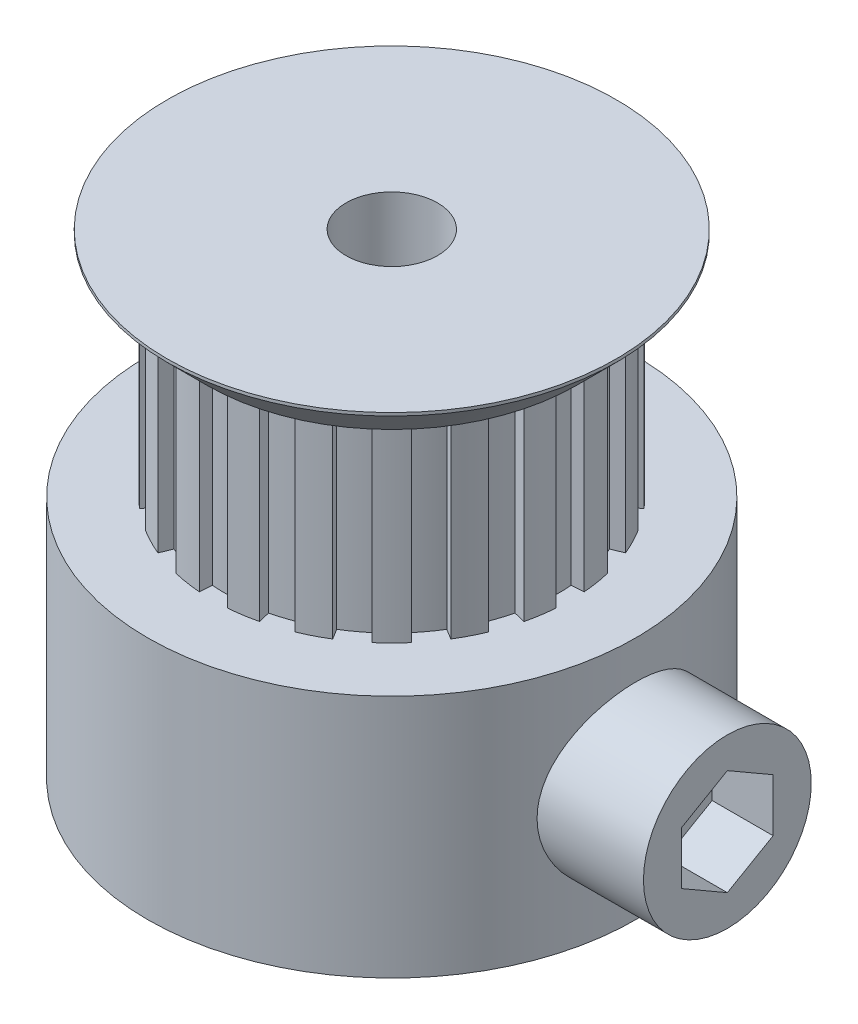
from build123d import *

# Parameters (mm, degrees)
SKETCH1_R           = 8
BOSS_EXTRUDE1_DEPTH = 8
SKETCH2_R           = 5.865
BOSS_EXTRUDE2_DEPTH = 6.2
CUT_EXTRUDE2_START  = -6.2
CUT_EXTRUDE2_DEPTH  = 6.2
SKETCH3_R           = 7.36
BOSS_EXTRUDE3_DEPTH = 1.4
CHAMFER1_SIZE       = 1.3
SKETCH4_R           = 2.75
BOSS_EXTRUDE4_DEPTH = 11
CUT_EXTRUDE1_DEPTH  = 2
SKETCH7_R           = 1.5
CUT_EXTRUDE3_DEPTH  = 21.696859757


with BuildPart() as part:
    # Sketch1 → Boss-Extrude1 (new body)
    with BuildSketch(Plane(origin=(0, 0, 0), x_dir=(1, 0, 0), z_dir=(0, 1, 0))):
        with Locations(Location((0, 0, 0), (0, 0, 270))):
            Circle(SKETCH1_R)
    extrude(amount=BOSS_EXTRUDE1_DEPTH)

    # Sketch2 → Boss-Extrude2 (add)
    with BuildSketch(Plane(origin=(0, 8, 0), x_dir=(1, 0, 0), z_dir=(0, 1, 0))):
        with Locations(Location((0, 0, 0), (0, 0, 90))):
            Circle(SKETCH2_R)
    extrude(amount=BOSS_EXTRUDE2_DEPTH)

    # Sketch6 → Cut-Extrude2 (cut)
    with BuildSketch(Plane(origin=(0, 14.2, 0), x_dir=(1, 0, 0), z_dir=(0, 1, 0)).offset(CUT_EXTRUDE2_START)):
        with BuildLine():
            Line((-0.460162596, 5.846920162), (-0.428778958, 5.448153229))
            ThreePointArc((-0.428778958, 5.448153229), (0, 5.465), (0.428778958, 5.448153229))
            Line((0.428778958, 5.448153229), (0.460162596, 5.846920162))
            ThreePointArc((0.460162596, 5.846920162), (0, 5.865), (-0.460162596, 5.846920162))
        make_face()
        with BuildLine():
            Line((2.244438331, 5.418553458), (2.091364958, 5.049001645))
            ThreePointArc((2.091364958, 5.049001645), (1.688777874, 5.197523862), (1.275778913, 5.314001615))
            Line((1.275778913, 5.314001615), (1.369157059, 5.702949583))
            ThreePointArc((1.369157059, 5.702949583), (1.812384672, 5.577946468), (2.244438331, 5.418553458))
        make_face()
        with BuildLine():
            Line((3.809012803, 4.459780988), (3.549233584, 4.155618602))
            ThreePointArc((3.549233584, 4.155618602), (3.212246404, 4.421277874), (2.855454656, 4.659678498))
            Line((2.855454656, 4.659678498), (3.064454082, 5.000734564))
            ThreePointArc((3.064454082, 5.000734564), (3.447360505, 4.744884672), (3.809012803, 4.459780988))
        make_face()
        with BuildLine():
            Line((5.000734564, 3.064454082), (4.659678498, 2.855454656))
            ThreePointArc((4.659678498, 2.855454656), (4.421277874, 3.212246404), (4.155618602, 3.549233584))
            Line((4.155618602, 3.549233584), (4.459780988, 3.809012803))
            ThreePointArc((4.459780988, 3.809012803), (4.744884672, 3.447360505), (5.000734564, 3.064454082))
        make_face()
        with BuildLine():
            Line((5.702949583, 1.369157059), (5.314001615, 1.275778913))
            ThreePointArc((5.314001615, 1.275778913), (5.197523862, 1.688777874), (5.049001645, 2.091364958))
            Line((5.049001645, 2.091364958), (5.418553458, 2.244438331))
            ThreePointArc((5.418553458, 2.244438331), (5.577946468, 1.812384672), (5.702949583, 1.369157059))
        make_face()
        with BuildLine():
            Line((5.846920162, -0.460162596), (5.448153229, -0.428778958))
            ThreePointArc((5.448153229, -0.428778958), (5.465, 0), (5.448153229, 0.428778958))
            Line((5.448153229, 0.428778958), (5.846920162, 0.460162596))
            ThreePointArc((5.846920162, 0.460162596), (5.865, 0), (5.846920162, -0.460162596))
        make_face()
        with BuildLine():
            Line((5.418553458, -2.244438331), (5.049001645, -2.091364958))
            ThreePointArc((5.049001645, -2.091364958), (5.197523862, -1.688777874), (5.314001615, -1.275778913))
            Line((5.314001615, -1.275778913), (5.702949583, -1.369157059))
            ThreePointArc((5.702949583, -1.369157059), (5.577946468, -1.812384672), (5.418553458, -2.244438331))
        make_face()
        with BuildLine():
            Line((4.459780988, -3.809012803), (4.155618602, -3.549233584))
            ThreePointArc((4.155618602, -3.549233584), (4.421277874, -3.212246404), (4.659678498, -2.855454656))
            Line((4.659678498, -2.855454656), (5.000734564, -3.064454082))
            ThreePointArc((5.000734564, -3.064454082), (4.744884672, -3.447360505), (4.459780988, -3.809012803))
        make_face()
        with BuildLine():
            Line((3.064454082, -5.000734564), (2.855454656, -4.659678498))
            ThreePointArc((2.855454656, -4.659678498), (3.212246404, -4.421277874), (3.549233584, -4.155618602))
            Line((3.549233584, -4.155618602), (3.809012803, -4.459780988))
            ThreePointArc((3.809012803, -4.459780988), (3.447360505, -4.744884672), (3.064454082, -5.000734564))
        make_face()
        with BuildLine():
            Line((1.369157059, -5.702949583), (1.275778913, -5.314001615))
            ThreePointArc((1.275778913, -5.314001615), (1.688777874, -5.197523862), (2.091364958, -5.049001645))
            Line((2.091364958, -5.049001645), (2.244438331, -5.418553458))
            ThreePointArc((2.244438331, -5.418553458), (1.812384672, -5.577946468), (1.369157059, -5.702949583))
        make_face()
        with BuildLine():
            Line((-0.460162596, -5.846920162), (-0.428778958, -5.448153229))
            ThreePointArc((-0.428778958, -5.448153229), (0, -5.465), (0.428778958, -5.448153229))
            Line((0.428778958, -5.448153229), (0.460162596, -5.846920162))
            ThreePointArc((0.460162596, -5.846920162), (0, -5.865), (-0.460162596, -5.846920162))
        make_face()
        with BuildLine():
            Line((-2.244438331, -5.418553458), (-2.091364958, -5.049001645))
            ThreePointArc((-2.091364958, -5.049001645), (-1.688777874, -5.197523862), (-1.275778913, -5.314001615))
            Line((-1.275778913, -5.314001615), (-1.369157059, -5.702949583))
            ThreePointArc((-1.369157059, -5.702949583), (-1.812384672, -5.577946468), (-2.244438331, -5.418553458))
        make_face()
        with BuildLine():
            Line((-3.809012803, -4.459780988), (-3.549233584, -4.155618602))
            ThreePointArc((-3.549233584, -4.155618602), (-3.212246404, -4.421277874), (-2.855454656, -4.659678498))
            Line((-2.855454656, -4.659678498), (-3.064454082, -5.000734564))
            ThreePointArc((-3.064454082, -5.000734564), (-3.447360505, -4.744884672), (-3.809012803, -4.459780988))
        make_face()
        with BuildLine():
            Line((-5.000734564, -3.064454082), (-4.659678498, -2.855454656))
            ThreePointArc((-4.659678498, -2.855454656), (-4.421277874, -3.212246404), (-4.155618602, -3.549233584))
            Line((-4.155618602, -3.549233584), (-4.459780988, -3.809012803))
            ThreePointArc((-4.459780988, -3.809012803), (-4.744884672, -3.447360505), (-5.000734564, -3.064454082))
        make_face()
        with BuildLine():
            Line((-5.702949583, -1.369157059), (-5.314001615, -1.275778913))
            ThreePointArc((-5.314001615, -1.275778913), (-5.197523862, -1.688777874), (-5.049001645, -2.091364958))
            Line((-5.049001645, -2.091364958), (-5.418553458, -2.244438331))
            ThreePointArc((-5.418553458, -2.244438331), (-5.577946468, -1.812384672), (-5.702949583, -1.369157059))
        make_face()
        with BuildLine():
            Line((-5.846920162, 0.460162596), (-5.448153229, 0.428778958))
            ThreePointArc((-5.448153229, 0.428778958), (-5.465, 0), (-5.448153229, -0.428778958))
            Line((-5.448153229, -0.428778958), (-5.846920162, -0.460162596))
            ThreePointArc((-5.846920162, -0.460162596), (-5.865, 0), (-5.846920162, 0.460162596))
        make_face()
        with BuildLine():
            Line((-5.418553458, 2.244438331), (-5.049001645, 2.091364958))
            ThreePointArc((-5.049001645, 2.091364958), (-5.197523862, 1.688777874), (-5.314001615, 1.275778913))
            Line((-5.314001615, 1.275778913), (-5.702949583, 1.369157059))
            ThreePointArc((-5.702949583, 1.369157059), (-5.577946468, 1.812384672), (-5.418553458, 2.244438331))
        make_face()
        with BuildLine():
            Line((-4.459780988, 3.809012803), (-4.155618602, 3.549233584))
            ThreePointArc((-4.155618602, 3.549233584), (-4.421277874, 3.212246404), (-4.659678498, 2.855454656))
            Line((-4.659678498, 2.855454656), (-5.000734564, 3.064454082))
            ThreePointArc((-5.000734564, 3.064454082), (-4.744884672, 3.447360505), (-4.459780988, 3.809012803))
        make_face()
        with BuildLine():
            Line((-3.064454082, 5.000734564), (-2.855454656, 4.659678498))
            ThreePointArc((-2.855454656, 4.659678498), (-3.212246404, 4.421277874), (-3.549233584, 4.155618602))
            Line((-3.549233584, 4.155618602), (-3.809012803, 4.459780988))
            ThreePointArc((-3.809012803, 4.459780988), (-3.447360505, 4.744884672), (-3.064454082, 5.000734564))
        make_face()
        with BuildLine():
            Line((-1.369157059, 5.702949583), (-1.275778913, 5.314001615))
            ThreePointArc((-1.275778913, 5.314001615), (-1.688777874, 5.197523862), (-2.091364958, 5.049001645))
            Line((-2.091364958, 5.049001645), (-2.244438331, 5.418553458))
            ThreePointArc((-2.244438331, 5.418553458), (-1.812384672, 5.577946468), (-1.369157059, 5.702949583))
        make_face()
    extrude(amount=CUT_EXTRUDE2_DEPTH, mode=Mode.SUBTRACT)

    # Sketch3 → Boss-Extrude3 (add)
    with BuildSketch(Plane(origin=(0, 14.2, 0), x_dir=(1, 0, 0), z_dir=(0, 1, 0))):
        with Locations(Location((0, 0, 0), (0, 0, 270))):
            Circle(SKETCH3_R)
    extrude(amount=BOSS_EXTRUDE3_DEPTH)

    # Chamfer1
    chamfer1_edges = [part.edges().sort_by_distance(p)[0] for p in [
        (0, 14.2, -7.36),
    ]]
    chamfer(chamfer1_edges, length=CHAMFER1_SIZE)

    # Sketch4 → Boss-Extrude4 (add)
    with BuildSketch(Plane(origin=(0, 0, 0), x_dir=(0, 0, -1), z_dir=(1, 0, 0))):
        with Locations(Location((0, 4, 0), (0, 0, 180))):
            Circle(SKETCH4_R)
    extrude(amount=BOSS_EXTRUDE4_DEPTH)

    # Sketch5 → Cut-Extrude1 (cut)
    with BuildSketch(Plane(origin=(11, 0, 0), x_dir=(0, 0, -1), z_dir=(1, 0, 0))):
        Polygon((0, 2.267949192), (1.5, 3.133974596), (1.5, 4.866025404), (0, 5.732050808), (-1.5, 4.866025404), (-1.5, 3.133974596), align=None)
    extrude(amount=-CUT_EXTRUDE1_DEPTH, mode=Mode.SUBTRACT)

    # Sketch7 → Cut-Extrude3 (cut, through all)
    with BuildSketch(Plane.XZ):
        with Locations(Location((0, 0, 0), (0, 0, 270))):
            Circle(SKETCH7_R)
    extrude(amount=-CUT_EXTRUDE3_DEPTH, mode=Mode.SUBTRACT)


solid = part.part
